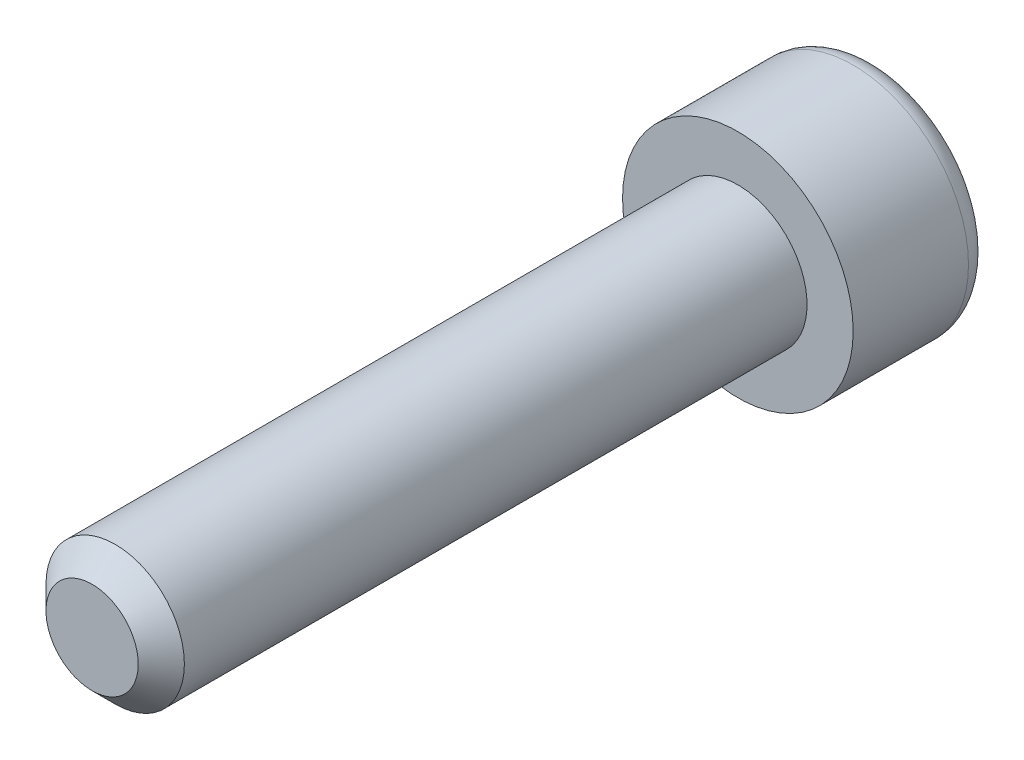
from build123d import *

# Parameters (mm, degrees)
ESQUISSE1_R             = 1.5
BASE_EXTRUSION_DEPTH    = 14
CHANFREIN1_SIZE         = 0.5
ESQUISSE2_R             = 2.5
BOSS_EXTRU_1_DEPTH      = 3
CONG_1_R                = 0.5
ENL_V_MAT_EXTRU_1_DEPTH = 2.5


with BuildPart() as part:
    # Esquisse1 → Base-Extrusion (new body)
    with BuildSketch(Plane.XY):
        Circle(ESQUISSE1_R)
    extrude(amount=BASE_EXTRUSION_DEPTH)

    # Chanfrein1
    chanfrein1_edges = [part.edges().sort_by_distance(p)[0] for p in [
        (-1.5, 0, 14),
    ]]
    chamfer(chanfrein1_edges, length=CHANFREIN1_SIZE)

    # Esquisse2 → Boss.-Extru.1 (add)
    with BuildSketch(Plane(origin=(0, 0, 0), x_dir=(-1, 0, 0), z_dir=(0, 0, -1))):
        Circle(ESQUISSE2_R)
    extrude(amount=BOSS_EXTRU_1_DEPTH)

    # Congé1
    cong_1_edges = [part.edges().sort_by_distance(p)[0] for p in [
        (2.5, 0, -3),
    ]]
    fillet(cong_1_edges, radius=CONG_1_R)

    # Esquisse3 → Enlèv. mat.-Extru.1 (cut)
    with BuildSketch(Plane(origin=(0, 0, -3), x_dir=(-1, 0, 0), z_dir=(0, 0, -1))):
        Polygon((1.732050808, 0), (0.866025404, 1.5), (-0.866025404, 1.5), (-1.732050808, 0), (-0.866025404, -1.5), (0.866025404, -1.5), align=None)
    extrude(amount=-ENL_V_MAT_EXTRU_1_DEPTH, mode=Mode.SUBTRACT)


solid = part.part
